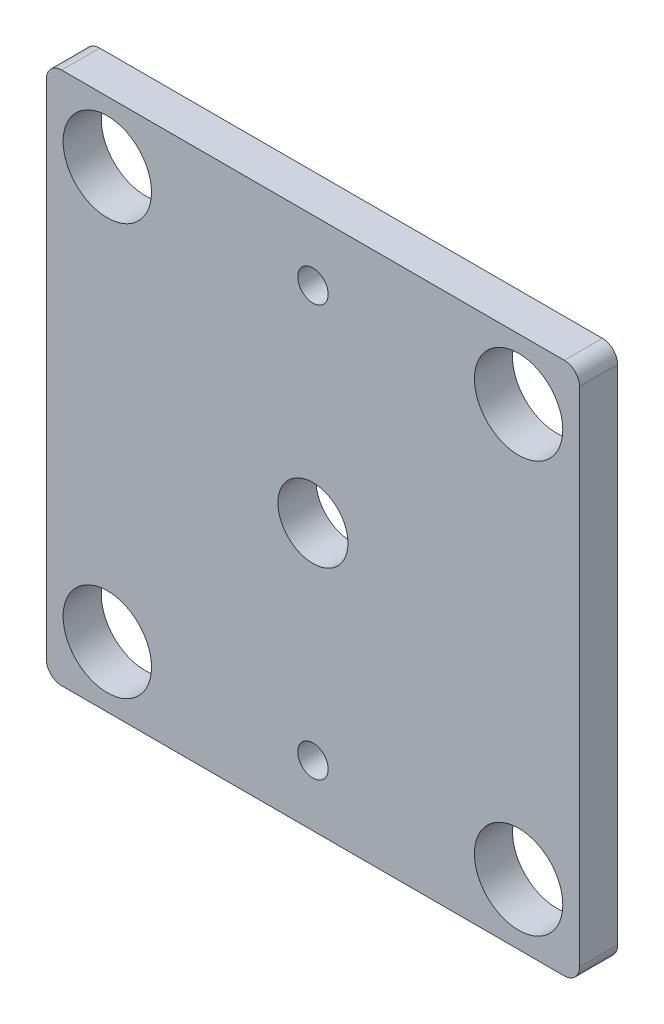
from build123d import *

# Parameters (mm, degrees)
SKETCH1_W           = 70
SKETCH1_H           = 70
SKETCH1_R           = 5.8
SKETCH1_R_2         = 4.6
SKETCH1_R_3         = 2
BOSS_EXTRUDE1_DEPTH = 5
FILLET1_R           = 2
FILLET2_R           = 2


with BuildPart() as part:
    # Sketch1 → Boss-Extrude1 (new body)
    with BuildSketch(Plane.XY):
        Rectangle(SKETCH1_W, SKETCH1_H)
        with Locations((-27, 27)):
            Circle(SKETCH1_R, mode=Mode.SUBTRACT)
        with Locations((27, 27)):
            Circle(SKETCH1_R, mode=Mode.SUBTRACT)
        with Locations((27, -27)):
            Circle(SKETCH1_R, mode=Mode.SUBTRACT)
        with Locations((-27, -27)):
            Circle(SKETCH1_R, mode=Mode.SUBTRACT)
        Circle(SKETCH1_R_2, mode=Mode.SUBTRACT)
        with Locations((0, 27)):
            Circle(SKETCH1_R_3, mode=Mode.SUBTRACT)
        with Locations((0, -27)):
            Circle(SKETCH1_R_3, mode=Mode.SUBTRACT)
    extrude(amount=BOSS_EXTRUDE1_DEPTH)

    # Fillet1
    fillet1_edges = [part.edges().sort_by_distance(p)[0] for p in [
        (-35, 35, 2.5),
        (35, 35, 2.5),
        (35, -35, 2.5),
    ]]
    fillet(fillet1_edges, radius=FILLET1_R)

    # Fillet2
    fillet2_edges = [part.edges().sort_by_distance(p)[0] for p in [
        (-35, -35, 2.5),
    ]]
    fillet(fillet2_edges, radius=FILLET2_R)


solid = part.part
